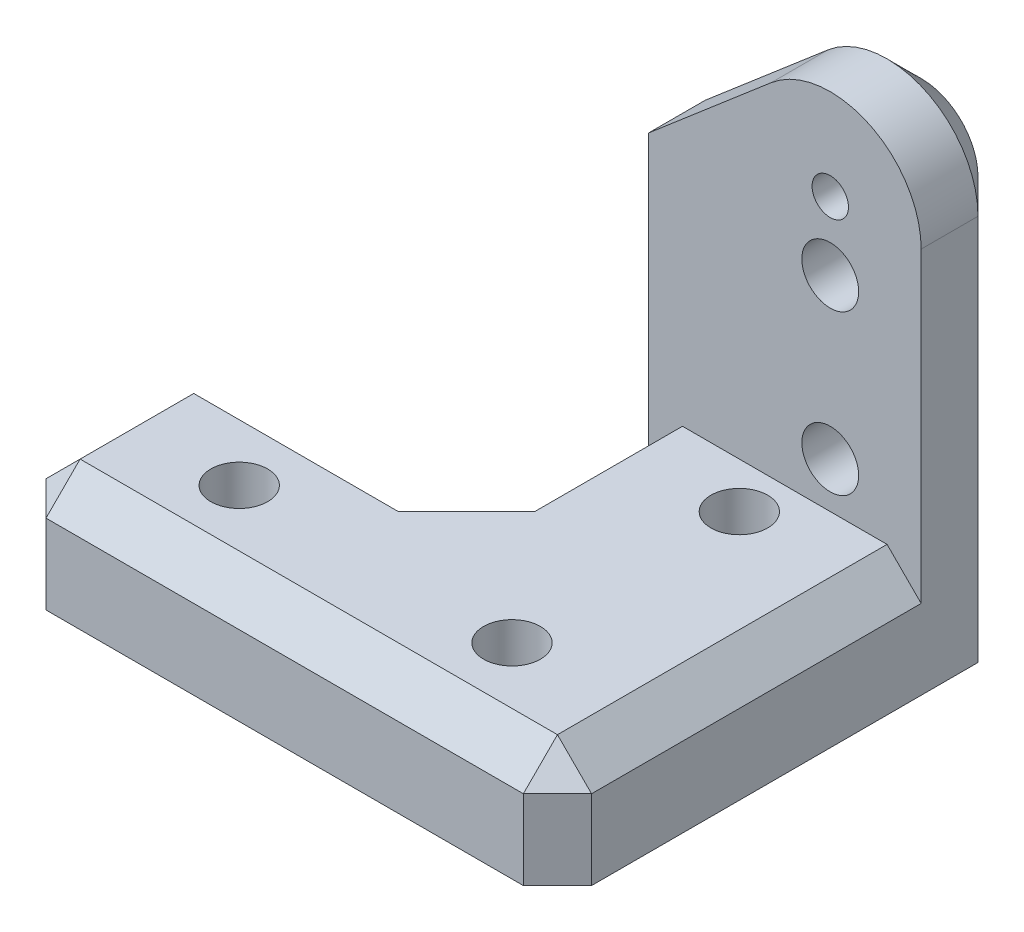
from build123d import *

# Parameters (mm, degrees)
RESSALTO_EXTRUS_O1_DEPTH                = 20
ESBO_O2_W                               = 16
ESBO_O2_H                               = 16
CORTE_EXTRUS_O1_DEPTH                   = 34.120990323
FURO_ROSCADO_DE_M21_D                   = 1.6
FURO_ROSCADO_DE_M21_DEPTH               = 6
FURO_ROSCADO_DE_M21_TIP                 = 0.480688495
CORTE_EXTRUS_O2_DEPTH                   = 34.120990323
ESBO_O9_W                               = 8
ESBO_O9_H                               = 5
RESSALTO_EXTRUS_O2_DEPTH                = 12
CHANFRO1_SIZE                           = 1.5
CHANFRO2_SIZE                           = 1.5
FURO_ROSCADO_DE_M31_D                   = 2.5
FURO_ROSCADO_DE_M31_DEPTH               = 8.5
FURO_ROSCADO_DE_M31_TIP                 = 0.751075774
BROCA_DE_ROSQUEAR_PARA_TARRAXA_DE_M31_D = 2.5


with BuildPart() as part:
    # Esboço1 → Ressalto-extrusão1 (new body)
    with BuildSketch(Plane.XY):
        with BuildLine():
            Line((0, 0), (0, 12))
            Line((0, 12), (9.400080843, 20.039805977))
            ThreePointArc((9.400080843, 20.039805977), (13.673368365, 20.633158174), (16, 17))
            Line((16, 17), (16, 4))
            Line((16, 4), (16, 0))
            Line((16, 0), (0, 0))
        make_face()
    extrude(amount=RESSALTO_EXTRUS_O1_DEPTH)

    # Esboço2 → Corte-extrusão1 (cut, through all)
    with BuildSketch(Plane.ZY):
        with Locations((12, 13)):
            Rectangle(ESBO_O2_W, ESBO_O2_H)
    extrude(amount=-CORTE_EXTRUS_O1_DEPTH, mode=Mode.SUBTRACT)

    # Furo roscado de M21
    with Locations(Plane(origin=(12, 17, 4), x_dir=(1, 0, 0), z_dir=(0, 0, 1))):
        with Locations((0, 0)):
            Hole(FURO_ROSCADO_DE_M21_D / 2, depth=FURO_ROSCADO_DE_M21_DEPTH)
            with Locations((0, 0, -(FURO_ROSCADO_DE_M21_DEPTH + FURO_ROSCADO_DE_M21_TIP / 2))):  # 118° drill point
                Cone(0, FURO_ROSCADO_DE_M21_D / 2, FURO_ROSCADO_DE_M21_TIP, mode=Mode.SUBTRACT)

    # Esboço6 → Corte-extrusão2 (cut, through all)
    with BuildSketch(Plane.XY.offset(20)):
        Polygon((0, 0), (4, 0), (4, 15.42116461), (0, 12), align=None)
    extrude(amount=-CORTE_EXTRUS_O2_DEPTH, mode=Mode.SUBTRACT)

    # Esboço9 → Ressalto-extrusão2 (add)
    with BuildSketch(Plane.ZY.offset(-4)):
        with Locations((16, 2.5)):
            Rectangle(ESBO_O9_W, ESBO_O9_H)
    extrude(amount=RESSALTO_EXTRUS_O2_DEPTH)

    # Chanfro1
    chanfro1_edges = [part.edges().sort_by_distance(p)[0] for p in [
        (4, 7.710582305, 0),
        (6.700040421, 17.730485293, 0),
        (13.673368365, 20.633158174, 0),
        (16, 8.5, 0),
    ]]
    chamfer(chanfro1_edges, length=CHANFRO1_SIZE)

    # Chanfro2
    chanfro2_edges = [part.edges().sort_by_distance(p)[0] for p in [
        (16, 5, 12),
        (4, 5, 20),
        (4, 5, 8),
        (4, 2.5, 12),
        (-2, 5, 12),
        (-8, 2.5, 20),
        (-8, 5, 16),
        (-8, 2.5, 12),
        (16, 2.5, 20),
    ]]
    chamfer(chanfro2_edges, length=CHANFRO2_SIZE)

    # Furo roscado de M31
    with Locations(Plane(origin=(10, 0, 6), x_dir=(0, 0, -1), z_dir=(0, -1, 0))):
        with Locations((0, 0), (-10, 0), (-10, -12)):
            Hole(FURO_ROSCADO_DE_M31_D / 2, depth=FURO_ROSCADO_DE_M31_DEPTH)
            with Locations((0, 0, -(FURO_ROSCADO_DE_M31_DEPTH + FURO_ROSCADO_DE_M31_TIP / 2))):  # 118° drill point
                Cone(0, FURO_ROSCADO_DE_M31_D / 2, FURO_ROSCADO_DE_M31_TIP, mode=Mode.SUBTRACT)

    # Broca de rosquear para tarraxa de M31 (through all)
    with Locations(Plane(origin=(12, 7, 0), x_dir=(-1, 0, 0), z_dir=(0, 0, -1))):
        with Locations((0, 0), (0, 7)):
            Hole(BROCA_DE_ROSQUEAR_PARA_TARRAXA_DE_M31_D / 2)


solid = part.part
